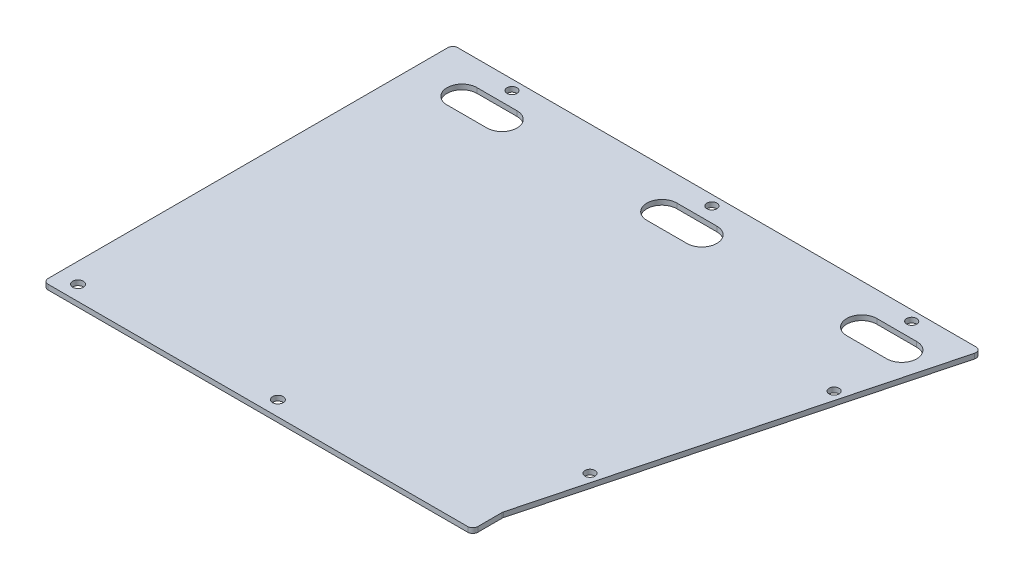
from build123d import *

# Parameters (mm, degrees)
BOSS_EXTRUDE1_DEPTH              = 3.175
FILLET1_R                        = 3.175
F_1_4_0_25_DIAMETER_HOLE1_D      = 6.35
F_17_64_0_26563_DIAMETER_HOLE1_D = 6.747002
SKETCH9_R                        = 3.175
CUT_EXTRUDE1_DEPTH               = 425.763278612


with BuildPart() as part:
    # Sketch1 → Boss-Extrude1 (new body)
    with BuildSketch(Plane(origin=(0, 0, 0), x_dir=(1, 0, 0), z_dir=(0, 1, 0))):
        Polygon((0, 0), (273.05, 0), (273.05, 19.05), (336.55, 260.35), (0, 260.35), align=None)
    extrude(amount=BOSS_EXTRUDE1_DEPTH)

    # Fillet1
    fillet1_edges = [part.edges().sort_by_distance(p)[0] for p in [
        (0, 1.5875, -260.35),
        (336.55, 1.5875, -260.35),
        (273.05, 1.5875, -19.05),
        (273.05, 1.5875, 0),
        (0, 1.5875, 0),
    ]]
    fillet(fillet1_edges, radius=FILLET1_R)

    # 1/4 (0.25) Diameter Hole1 (through all)
    with Locations(Plane(origin=(0, 3.175, 0), x_dir=(1, 0, 0), z_dir=(0, 1, 0))):
        with Locations((43.97818809, 254), (170.97818809, 254), (297.97818809, 254), (311.721536551, 190.953379927), (279.400887542, 68.134913694)):
            Hole(F_1_4_0_25_DIAMETER_HOLE1_D / 2)

    # 17/64 (0.26563) Diameter Hole1 (through all)
    with Locations(Plane(origin=(0, 3.175, 0), x_dir=(1, 0, 0), z_dir=(0, 1, 0))):
        with Locations((12.7, 9.525), (139.7, 9.525)):
            Hole(F_17_64_0_26563_DIAMETER_HOLE1_D / 2)

    # Sketch9 → Cut-Extrude1 (cut, through all)
    with BuildSketch(Plane(origin=(0, 3.175, 0), x_dir=(1, 0, 0), z_dir=(0, 1, 0))):
        with Locations(Location((297.97818809, 254, 0), (0, 0, 270))):
            Circle(SKETCH9_R)
        with Locations(Location((170.97818809, 254, 0), (0, 0, 270))):
            Circle(SKETCH9_R)
        with Locations(Location((43.97818809, 254, 0), (0, 0, 270))):
            Circle(SKETCH9_R)
        with BuildLine():
            Line((31.27818809, 244.475), (56.67818809, 244.475))
            ThreePointArc((56.67818809, 244.475), (66.20318809, 234.95), (56.67818809, 225.425))
            Line((56.67818809, 225.425), (31.27818809, 225.425))
            ThreePointArc((31.27818809, 225.425), (21.75318809, 234.95), (31.27818809, 244.475))
        make_face()
        with BuildLine():
            Line((158.27818809, 244.475), (183.67818809, 244.475))
            ThreePointArc((183.67818809, 244.475), (193.20318809, 234.95), (183.67818809, 225.425))
            Line((183.67818809, 225.425), (158.27818809, 225.425))
            ThreePointArc((158.27818809, 225.425), (148.75318809, 234.95), (158.27818809, 244.475))
        make_face()
        with BuildLine():
            Line((285.27818809, 244.475), (310.67818809, 244.475))
            ThreePointArc((310.67818809, 244.475), (320.20318809, 234.95), (310.67818809, 225.425))
            Line((310.67818809, 225.425), (285.27818809, 225.425))
            ThreePointArc((285.27818809, 225.425), (275.75318809, 234.95), (285.27818809, 244.475))
        make_face()
    extrude(amount=-CUT_EXTRUDE1_DEPTH, mode=Mode.SUBTRACT)


solid = part.part
